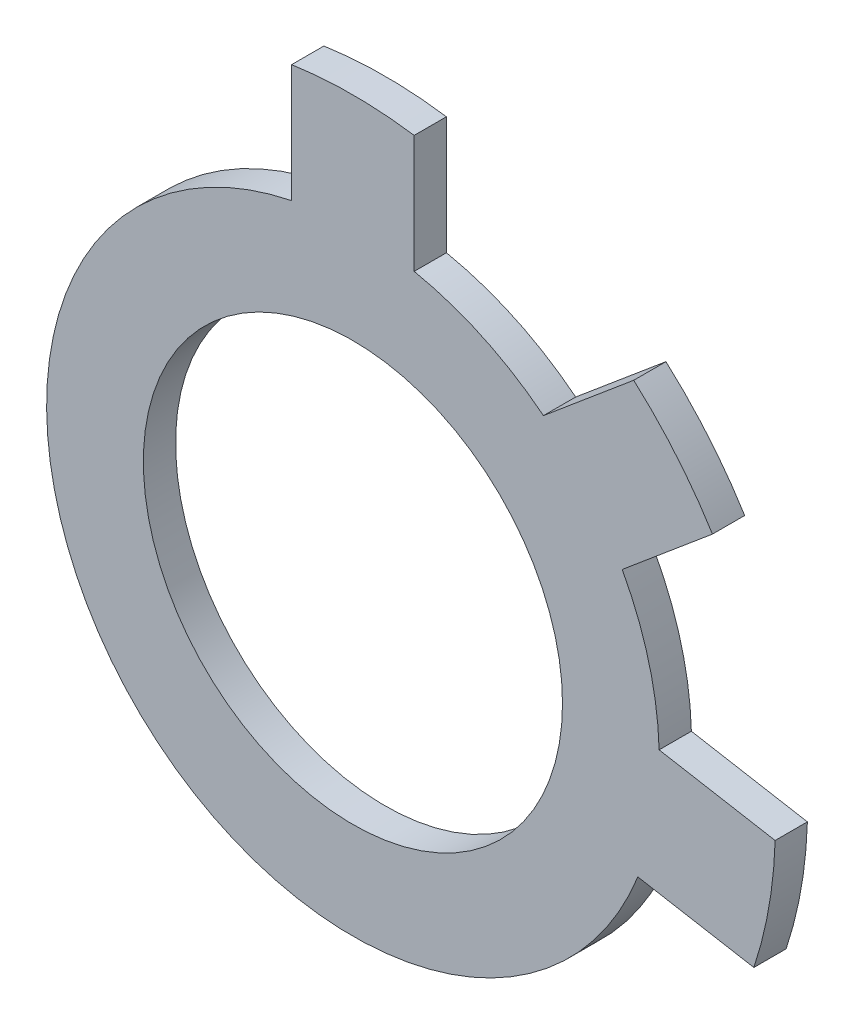
from build123d import *

# Parameters (mm, degrees)
SKETCH_1_R      = 6.5
EXTRUDE_1_DEPTH = 1


with BuildPart() as part:
    # 草图1 → 拉伸1 (new body)
    with BuildSketch(Plane.XY):
        with BuildLine():
            Line((8.351684881, 4.527621854), (11.150367257, 6.875995203))
            ThreePointArc((11.150367257, 6.875995203), (10.035182205, 8.420517687), (8.70777434, 9.786964087))
            Line((8.70777434, 9.786964087), (5.909091964, 7.438590737))
            ThreePointArc((5.909091964, 7.438590737), (4.014873487, 8.609923977), (1.9, 9.308061023))
            Line((1.9, 9.308061023), (1.9, 12.961481397))
            ThreePointArc((1.9, 12.961481397), (0, 13.1), (-1.9, 12.961481397))
            Line((-1.9, 12.961481397), (-1.9, 9.308061023))
            ThreePointArc((-1.9, 9.308061023), (-7.27742221, -6.106482292), (8.836719123, -3.487462565))
            Line((8.836719123, -3.487462565), (12.434635833, -4.121872355))
            ThreePointArc((12.434635833, -4.121872355), (12.900981564, -2.274791127), (13.094498908, -0.379602894))
            Line((13.094498908, -0.379602894), (9.496582198, 0.254806897))
            ThreePointArc((9.496582198, 0.254806897), (9.17629535, 2.458780928), (8.351684881, 4.527621854))
        make_face()
        Circle(SKETCH_1_R, mode=Mode.SUBTRACT)
    extrude(amount=EXTRUDE_1_DEPTH)


solid = part.part
